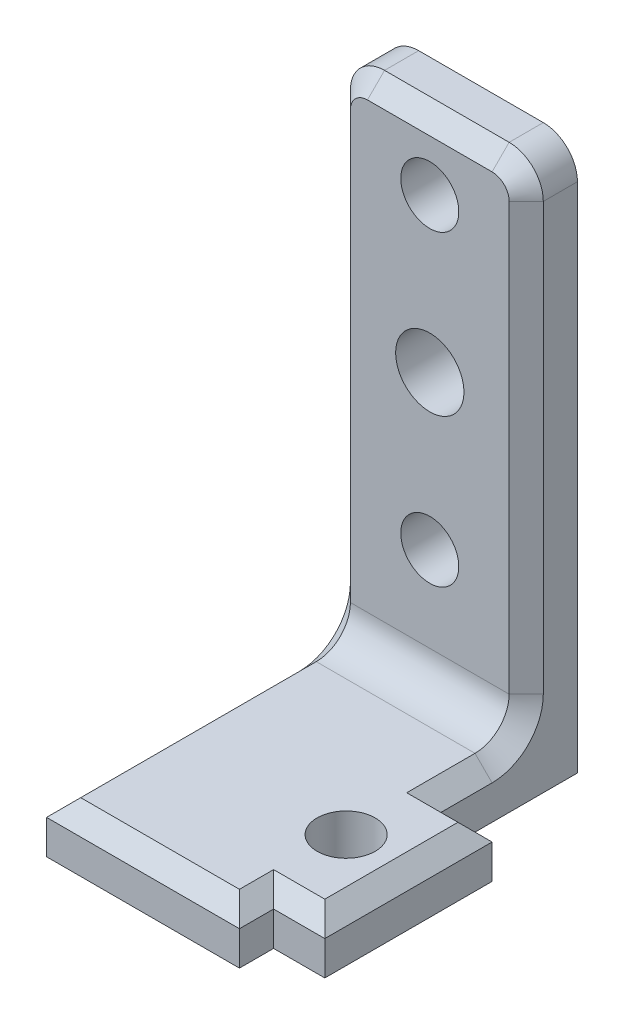
from build123d import *

# Parameters (mm, degrees)
SKETCH1_R           = 1.7
BOSS_EXTRUDE1_DEPTH = 3
SKETCH2_W           = 11.3
SKETCH2_H           = 3
BOSS_EXTRUDE2_DEPTH = 29
SKETCH3_R           = 1.7
SKETCH3_R_2         = 2
CUT_EXTRUDE1_DEPTH  = 3
FILLET1_R           = 2
CHAMFER1_SIZE       = 1


with BuildPart() as part:
    # Sketch1 → Boss-Extrude1 (new body)
    with BuildSketch(Plane(origin=(0, 0, 0), x_dir=(1, 0, 0), z_dir=(0, 1, 0))):
        Polygon((5.65, 9.9), (-5.65, 9.9), (-5.65, -9.9), (5.65, -9.9), (5.65, -7.9), (8.65, -7.9), (8.65, 1.9), (5.65, 1.9), align=None)
        with Locations(Location((5, -3, 0), (0, 0, 270))):
            Circle(SKETCH1_R, mode=Mode.SUBTRACT)
    extrude(amount=BOSS_EXTRUDE1_DEPTH)

    # Sketch2 → Boss-Extrude2 (add)
    with BuildSketch(Plane(origin=(0, 3, 0), x_dir=(1, 0, 0), z_dir=(0, 1, 0))):
        with Locations((0, 8.4)):
            Rectangle(SKETCH2_W, SKETCH2_H)
    extrude(amount=BOSS_EXTRUDE2_DEPTH)

    # Sketch3 → Cut-Extrude1 (cut)
    with BuildSketch(Plane(origin=(0, 0, -9.9), x_dir=(-1, 0, 0), z_dir=(0, 0, -1))):
        with Locations((0, 28)):
            Circle(SKETCH3_R)
        with Locations((0, 10)):
            Circle(SKETCH3_R)
        with Locations((0, 19)):
            Circle(SKETCH3_R_2)
    extrude(amount=-CUT_EXTRUDE1_DEPTH, mode=Mode.SUBTRACT)

    # Fillet1
    fillet1_edges = [part.edges().sort_by_distance(p)[0] for p in [
        (0, 3, -6.9),
        (-5.65, 32, -8.4),
        (5.65, 32, -8.4),
    ]]
    fillet(fillet1_edges, radius=FILLET1_R)

    # Chamfer1
    chamfer1_edges = [part.edges().sort_by_distance(p)[0] for p in [
        (7.15, 3, -1.9),
        (0, 3, 9.9),
        (5.65, 3, 8.9),
        (7.15, 3, 7.9),
        (8.65, 3, 3),
        (5.65, 17.5, -6.9),
        (0, 32, -6.9),
        (-5.65, 17.5, -6.9),
        (-5.064213562, 31.414213562, -6.9),
        (5.064213562, 31.414213562, -6.9),
        (-5.65, 3, 2.5),
        (5.65, 3, -3.4),
        (5.65, 3.585786438, -6.314213562),
        (-5.65, 3.585786438, -6.314213562),
    ]]
    chamfer(chamfer1_edges, length=CHAMFER1_SIZE)


solid = part.part
